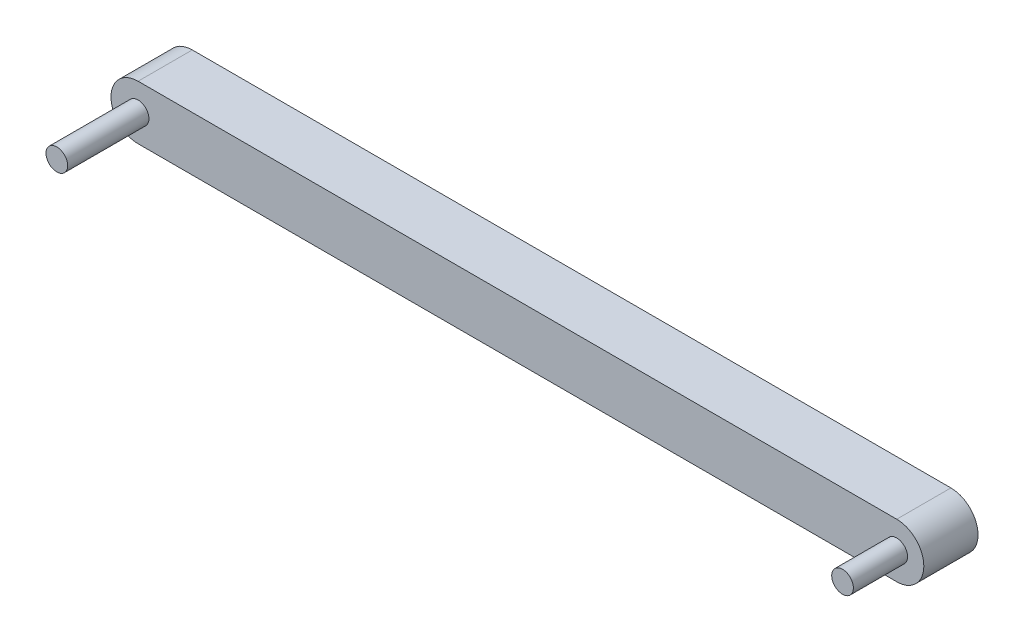
from build123d import *

# Parameters (mm, degrees)
BOSS_EXTRUDE1_DEPTH = 100
SKETCH2_R           = 20
BOSS_EXTRUDE3_DEPTH = 150
SKETCH4_R           = 20
BOSS_EXTRUDE4_DEPTH = 100


with BuildPart() as part:
    # Sketch1 → Boss-Extrude1 (new body)
    with BuildSketch(Plane.XY):
        with BuildLine():
            Line((0, 0), (1400, 0))
            ThreePointArc((1400, 0), (1450, 50), (1400, 100))
            Line((1400, 100), (0, 100))
            ThreePointArc((0, 100), (-50, 50), (0, 0))
        make_face()
    extrude(amount=BOSS_EXTRUDE1_DEPTH)

    # Sketch2 → Boss-Extrude3 (add)
    with BuildSketch(Plane.XY.offset(100)):
        with Locations((0, 50)):
            Circle(SKETCH2_R)
    extrude(amount=BOSS_EXTRUDE3_DEPTH)

    # Sketch4 → Boss-Extrude4 (add)
    with BuildSketch(Plane.XY.offset(100)):
        with Locations((1400, 50)):
            Circle(SKETCH4_R)
    extrude(amount=BOSS_EXTRUDE4_DEPTH)


solid = part.part
